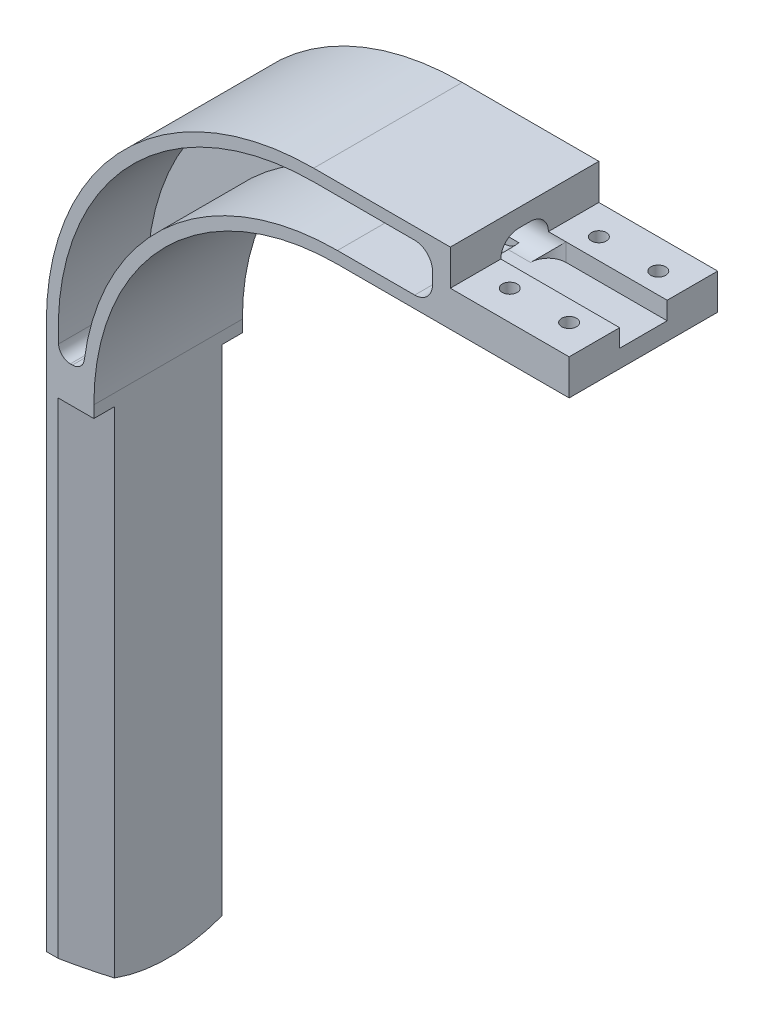
from build123d import *

# Parameters (mm, degrees)
EXTRUDE_1_DEPTH      = 25
SKETCH_2_W           = 20.000000000000014
SKETCH_2_H           = 6
CUT_EXTRUDE_1_DEPTH  = 168.23934943666816
CUT_EXTRUDE_2_DEPTH  = 85
CUT_EXTRUDE_4_DEPTH  = 5
CUT_EXTRUDE_3_REACH  = 169.239
FILLET_3_R           = 2
FILLET_4_R           = 3
CUT_EXTRUDE_6_DEPTH  = 75
M3X0_51_D            = 2.5
CUT_EXTRUDE_7_REACH  = 169.239
CUT_EXTRUDE_8_DEPTH  = 3
FILLET_8_R           = 3
CUT_EXTRUDE_9_DEPTH  = 28
CUT_EXTRUDE_10_DEPTH = 6
EXTRUDE_2_DEPTH      = 5
M3X0_52_D            = 2.5
M3X0_52_DEPTH        = 4
M3X0_52_TIP          = 0.7510757737844503


with BuildPart() as part:
    # Эскиз1 → Бобышка-Вытянуть1 (new body)
    with BuildSketch(Plane.XY):
        with BuildLine():
            Line((0, 0), (0, 95))
            ThreePointArc((0, 95), (13.18019484660537, 126.81980515339464), (45, 140))
            Line((45, 140), (88, 140))
            Line((88, 140), (88, 128))
            Line((88, 128), (49, 127.99999999999997))
            ThreePointArc((49, 127.99999999999997), (20.00862197135158, 115.99137802864843), (8.000000000000002, 87))
            Line((8.000000000000002, 87), (8, 0))
            Line((8, 0), (0, 0))
        make_face()
    extrude(amount=EXTRUDE_1_DEPTH)

    # Эскиз2 → Вырез-Вытянуть1 (cut, through all)
    with BuildSketch(Plane.XY.offset(25)):
        with Locations((78, 137)):
            Rectangle(SKETCH_2_W, SKETCH_2_H)
    extrude(amount=-CUT_EXTRUDE_1_DEPTH, mode=Mode.SUBTRACT)

    # Эскиз5 → Вырез-Вытянуть2 (cut)
    with BuildSketch(Plane.XZ):
        Polygon((8, 3.4641016151377366), (2, 0), (8, 0), (10.194072484648698, 0), (10.1940724846487, 4.730849954771208), align=None)
        Polygon((1.9999999999999971, 25), (7.999999999999993, 25), (10.194072484648695, 25), (10.194072484648698, 20.26915004522879), (7.999999999999998, 21.535898384862264), align=None)
    extrude(amount=-CUT_EXTRUDE_2_DEPTH, mode=Mode.SUBTRACT)

    # Эскиз6 → Вырез-Вытянуть4 (cut)
    with BuildSketch(Plane.ZY):
        with BuildLine():
            Line((10.000000000000004, -11.916065179701535), (10.000000000000004, 92.5))
            ThreePointArc((10.000000000000004, 92.5), (12.500000000000004, 95), (15.000000000000005, 92.5))
            Line((15.000000000000005, 92.5), (15.000000000000005, -11.916065179701535))
            ThreePointArc((15.000000000000005, -11.916065179701535), (12.500000000000004, -14.416065179701535), (10.000000000000004, -11.916065179701535))
        make_face()
    extrude(amount=-CUT_EXTRUDE_4_DEPTH, mode=Mode.SUBTRACT)

    # Вырез-Вытянуть3: up to this face of the body (flat: up to its plane)
    cut_extrude_3_end = Plane(part.part.faces().sort_by_distance((2.5, 46.25, 10))[0])
    # Эскиз3 → Вырез-Вытянуть3 (cut, up to the picked face)
    with BuildSketch(Plane(origin=(0, 0, 25), x_dir=(-1, 0, 0), z_dir=(0, 0, -1)), mode=Mode.PRIVATE) as cut_extrude_3_sk1:
        with BuildLine():
            Line((-64.99999999999999, 138), (-64.99999999999999, 130))
            Line((-64.99999999999999, 130), (-49.00000000000001, 130))
            ThreePointArc((-49.00000000000001, 130), (-20.04313552885945, 118.78836265050464), (-6.186450742784722, 90.9999999999999))
            Line((-6.186450742784722, 90.9999999999999), (-2.186450742784722, 90.9999999999999))
            ThreePointArc((-2.186450742784722, 90.9999999999999), (-13.211637349495152, 123.9568644711403), (-44.999999999999545, 138))
            Line((-44.999999999999545, 138), (-64.99999999999999, 138))
        make_face()
    cut_extrude_3_tool1 = split(extrude(cut_extrude_3_sk1.sketch, amount=CUT_EXTRUDE_3_REACH, mode=Mode.PRIVATE), bisect_by=cut_extrude_3_end, keep=Keep.BOTH, mode=Mode.PRIVATE)
    add(cut_extrude_3_tool1.solids().sort_by(Axis((55, 137.213997, 25), (0, 0, -1)))[0], mode=Mode.SUBTRACT)

    # Скругление3
    fillet_3_edges = [part.edges().sort_by_distance(p)[0] for p in [
        (6.186450742784729, 90.9999999999999, 17.5),
        (2.186450742784718, 90.9999999999999, 20.000000000000004),
    ]]
    fillet(fillet_3_edges, radius=FILLET_3_R)

    # Скругление4
    fillet_4_edges = [part.edges().sort_by_distance(p)[0] for p in [
        (64.99999999999999, 138, 17.5),
        (64.99999999999999, 130, 17.5),
    ]]
    fillet(fillet_4_edges, radius=FILLET_4_R)

    # Эскиз8 → Вырез-Вытянуть6 (cut)
    with BuildSketch(Plane(origin=(0, 10, 0), x_dir=(1, 0, 0), z_dir=(0, 1, 0))):
        Polygon((0, -2), (1.5, -2), (1.5, -3), (3.4999999999999996, -3), (3.4999999999999996, -4.0000000000000036), (5.499999999999993, -4.0000000000000036), (5.499999999999994, -8.000000000000004), (0, -8.000000000000004), align=None)
        Polygon((3.500000000000003, -22.000000000000004), (3.500000000000003, -20.999999999999996), (5.499999999999995, -20.999999999999996), (5.499999999999996, -16.999999999999996), (6.94e-15, -16.999999999999996), (6.94e-15, -23), (1.5000000000000036, -23), (1.5000000000000036, -22.000000000000004), align=None)
    extrude(amount=CUT_EXTRUDE_6_DEPTH, mode=Mode.SUBTRACT)

    # Отверстие обработанное метчиком M3x0.51 (through all)
    with Locations(Plane(origin=(19.191951444358242, 134, 18.79968596761044), x_dir=(1, 0, 0), z_dir=(0, 1, 0))):
        with Locations((53.808048556, 13.799685968), (63.808048556, 13.799685968), (63.808048556, -1.200314032), (53.808048556, -1.200314032)):
            Hole(M3X0_51_D / 2)

    # Эскиз12 → Вырез-Вытянуть7 (cut, up to next)
    with BuildSketch(Plane.ZY, mode=Mode.PRIVATE) as cut_extrude_7_sk1:
        with BuildLine():
            Line((0, 3.301973769644008), (0, 0))
            Line((0, 0), (12.500000000000004, -3.47e-15))
            Line((12.500000000000004, -3.47e-15), (25, 0))
            Line((25, 0), (25, 3.301973769644008))
            ThreePointArc((25, 3.301973769644008), (12.500000000000005, 0.10000000000000142), (0, 3.301973769644008))
        make_face()
    cut_extrude_7_tool1 = extrude(cut_extrude_7_sk1.sketch, amount=-CUT_EXTRUDE_7_REACH, mode=Mode.PRIVATE) & part.part
    add(cut_extrude_7_tool1.solids().sort_by_distance((0, 1.650987, 0.252171))[0], mode=Mode.SUBTRACT)

    # Эскиз13 → Вырез-Вытянуть8 (cut)
    with BuildSketch(Plane(origin=(0, 134, 0), x_dir=(1, 0, 0), z_dir=(0, 1, 0))):
        Polygon((68.00000000000009, -8.5), (88.00000000000001, -8.499999999999996), (88.00000000000001, -16.5), (68.00000000000009, -16.499999999999996), align=None)
    extrude(amount=-CUT_EXTRUDE_8_DEPTH, mode=Mode.SUBTRACT)

    # Скругление8
    fillet_8_edges = [part.edges().sort_by_distance(p)[0] for p in [
        (68.00000000000009, 132.5, 16.499999999999996),
        (68.00000000000009, 132.5, 8.5),
    ]]
    fillet(fillet_8_edges, radius=FILLET_8_R)

    # Эскиз14 → Вырез-Вытянуть9 (cut)
    with BuildSketch(Plane(origin=(88, 0, 0), x_dir=(0, 0, -1), z_dir=(1, -1.16e-15, 0))):
        with BuildLine():
            Line((-13.499999999999998, 137), (-11.5, 137))
            ThreePointArc((-11.5, 137), (-8.5, 134), (-11.5, 131))
            Line((-11.5, 131), (-13.499999999999998, 131))
            ThreePointArc((-13.499999999999998, 131), (-16.5, 134), (-13.499999999999998, 137))
        make_face()
    extrude(amount=-CUT_EXTRUDE_9_DEPTH, mode=Mode.SUBTRACT)

    # Эскиз15 → Вырез-Вытянуть10 (cut)
    with BuildSketch(Plane.ZY):
        with BuildLine():
            Line((15.000000000000004, 92.5), (15.000000000000004, 85.49999999999999))
            ThreePointArc((15.000000000000004, 85.49999999999999), (12.500000000000005, 82.99999999999999), (10.000000000000007, 85.49999999999999))
            Line((10.000000000000007, 85.49999999999999), (10.000000000000005, 92.5))
            ThreePointArc((10.000000000000005, 92.5), (12.500000000000004, 95), (15.000000000000004, 92.5))
        make_face()
    extrude(amount=-CUT_EXTRUDE_10_DEPTH, mode=Mode.SUBTRACT)

    # Эскиз19 → Бобышка-Вытянуть2 (add)
    with BuildSketch(Plane.ZY):
        with BuildLine():
            Line((10.000000000000002, 10.100000000000001), (10.000000000000004, 0.22047141078493024))
            ThreePointArc((10.000000000000004, 0.22047141078493024), (12.500000000000005, 0.09999999999999787), (15.000000000000004, 0.22047141078493718))
            Line((15.000000000000004, 0.22047141078493718), (15.000000000000002, 10.100000000000001))
            Line((15.000000000000002, 10.100000000000001), (10.000000000000002, 10.100000000000001))
        make_face()
    extrude(amount=-EXTRUDE_2_DEPTH)

    # Отверстие обработанное метчиком M3x0.52
    with Locations(Plane.ZY):
        with Locations((12.5, 5.1)):
            Hole(M3X0_52_D / 2, depth=M3X0_52_DEPTH)
            with Locations((0, 0, -(M3X0_52_DEPTH + M3X0_52_TIP / 2))):  # 118° drill point
                Cone(0, M3X0_52_D / 2, M3X0_52_TIP, mode=Mode.SUBTRACT)


solid = part.part
